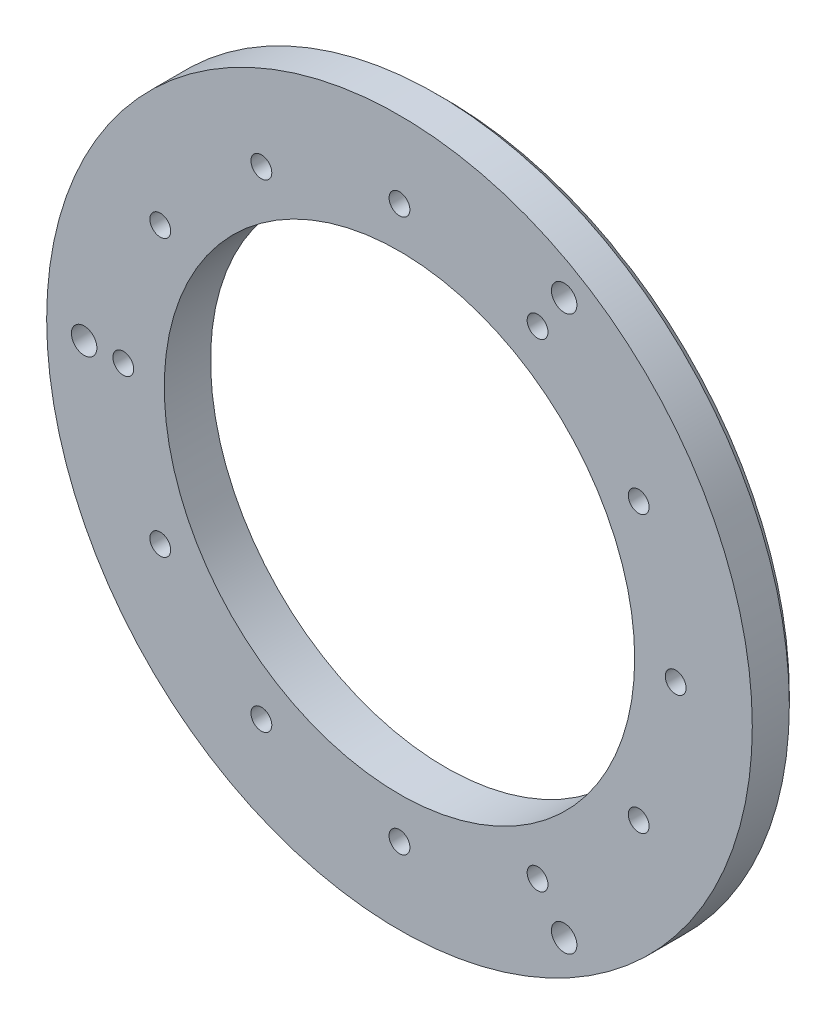
from build123d import *

# Parameters (mm, degrees)
ESQUISSE2_R                                    = 76.2
ESQUISSE2_R_2                                  = 50.8
BOSS_EXTRU_1_DEPTH                             = 10
CHANFREIN1_SIZE                                = 2
D_GAGEMENT_81_D                                = 4.4958
FRAISAGE_POUR_VIS_T_TE_FRAIS_E_M51_D           = 5.5
FRAISAGE_POUR_VIS_T_TE_FRAIS_E_M51_CSINK_D     = 10.4
FRAISAGE_POUR_VIS_T_TE_FRAIS_E_M51_CSINK_ANGLE = 90


with BuildPart() as part:
    # Esquisse2 → Boss.-Extru.1 (new body)
    with BuildSketch(Plane.XY):
        Circle(ESQUISSE2_R)
        Circle(ESQUISSE2_R_2, mode=Mode.SUBTRACT)
    extrude(amount=BOSS_EXTRU_1_DEPTH)

    # Chanfrein1
    chanfrein1_edges = [part.edges().sort_by_distance(p)[0] for p in [
        (-76.2, 0, 0),
    ]]
    chamfer(chanfrein1_edges, length=CHANFREIN1_SIZE)

    # Dégagement #81 (through all)
    with Locations(Plane(origin=(0, 0, 0), x_dir=(-1, 0, 0), z_dir=(0, 0, -1))):
        with Locations((0, 59.65), (51.658415336, 29.825), (29.825, 51.658415336), (59.65, 0), (51.658415336, -29.825), (29.825, -51.658415336), (0, -59.65), (-29.825, -51.658415336), (-51.658415336, -29.825), (-59.65, 0), (-51.658415336, 29.825), (-29.825, 51.658415336)):
            Hole(D_GAGEMENT_81_D / 2)

    # Fraisage pour vis à tête fraisée M51 (through all)
    with Locations(Plane(origin=(0, 0, 0), x_dir=(-1, 0, 0), z_dir=(0, 0, -1))):
        with Locations((68.1, 0), (-35.565, -59.851015656), (-35.565, 59.851015656)):
            CounterSinkHole(FRAISAGE_POUR_VIS_T_TE_FRAIS_E_M51_D / 2, FRAISAGE_POUR_VIS_T_TE_FRAIS_E_M51_CSINK_D / 2, counter_sink_angle=FRAISAGE_POUR_VIS_T_TE_FRAIS_E_M51_CSINK_ANGLE)


solid = part.part
